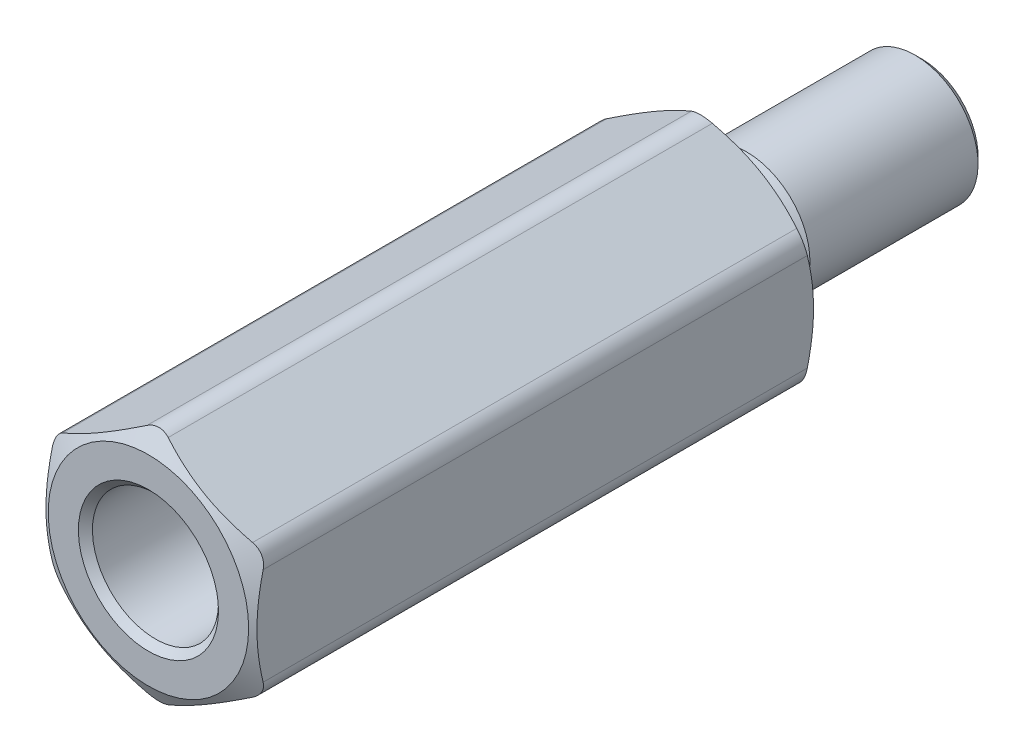
from build123d import *

# Parameters (mm, degrees)
SKETCH4_R           = 1.901825
BOSS_EXTRUDE1_DEPTH = 12.7
SKETCH5_OUTSIDE_W   = 75.8
SKETCH5_OUTSIDE_H   = 76.538
SKETCH5_OUTSIDE_R   = 2.2621875
CUT_EXTRUDE1_DEPTH  = 18.837312762
CUT_EXTRUDE1_DRAFT  = -60
SKETCH6_OUTSIDE_W   = 59.772
SKETCH6_OUTSIDE_H   = 60.51
SKETCH6_OUTSIDE_R   = 2.2621875
CUT_EXTRUDE2_DEPTH  = 14.210632851
CUT_EXTRUDE2_DRAFT  = -60
FILLET1_R           = 0.47625


with BuildPart() as part:
    # Sketch3 → Revolve1 (revolve)
    with BuildSketch(Plane(origin=(0, 0, 0), x_dir=(0, 0, -1), z_dir=(1, 0, 0))):
        with BuildLine():
            Line((-6.35, 1.26365), (-6.35, 0))
            Line((-6.35, 0), (4.7625, 0))
            Line((4.7625, 0), (4.7625, 1.26365))
            Line((4.7625, 1.26365), (4.60375, 1.4224))
            Line((4.60375, 1.4224), (0.809625, 1.4224))
            Line((0.809625, 1.4224), (0.5715, 1.009955401))
            Line((0.5715, 1.009955401), (0.15875, 1.009955401))
            ThreePointArc((0.15875, 1.009955401), (0.046496798, 1.0564522), (0, 1.168705401))
            Line((0, 1.168705401), (0, 2.38125))
            Line((0, 2.38125), (-12.7, 2.38125))
            Line((-12.7, 2.38125), (-12.7, 1.58115))
            Line((-12.7, 1.58115), (-12.54125, 1.4224))
            Line((-12.54125, 1.4224), (-6.50875, 1.4224))
            Line((-6.50875, 1.4224), (-6.35, 1.26365))
        make_face()
    revolve(axis=Axis((0, 0, -4.7625), (0, 0, 1)))

    # Sketch4 → Boss-Extrude1 (add)
    with BuildSketch(Plane.XY.offset(12.7)):
        Polygon((-2.38125, 1.374815329), (-2.38125, -1.374815329), (0, -2.749630657), (2.38125, -1.374815329), (2.38125, 1.374815329), (0, 2.749630657), align=None)
        Circle(SKETCH4_R, mode=Mode.SUBTRACT)
    extrude(amount=-BOSS_EXTRUDE1_DEPTH)


with BuildPart() as cut_extrude1_tool:
    # Sketch5 outside → Cut-Extrude1 (with draft: the straight prism first)
    with BuildSketch(Plane.XY.offset(12.7)):
        Rectangle(SKETCH5_OUTSIDE_W, SKETCH5_OUTSIDE_H)
        Circle(SKETCH5_OUTSIDE_R, mode=Mode.SUBTRACT)
    extrude(amount=-CUT_EXTRUDE1_DEPTH)
    # Cut-Extrude1: the draft: its side faces are tilted about the plane it starts from
    cut_extrude1_sides = [cut_extrude1_tool.faces().sort_by_distance(p)[0] for p in [
        (0, -38.269, 3.281343619),
        (37.9, 0, 3.281343619),
        (0, 38.269, 3.281343619),
        (-37.9, 0, 3.281343619),
        (-2.2621875, 0, 3.281343619),
    ]]
    draft(cut_extrude1_sides, Plane.XY.offset(12.7), CUT_EXTRUDE1_DRAFT)


with BuildPart() as part_1:
    add(part.part)

    # Cut-Extrude1: cut by cut_extrude1_tool
    add(cut_extrude1_tool.part, mode=Mode.SUBTRACT)


with BuildPart() as cut_extrude2_tool:
    # Sketch6 outside → Cut-Extrude2 (with draft: the straight prism first)
    with BuildSketch(Plane(origin=(0, 0, 0), x_dir=(-1, 0, 0), z_dir=(0, 0, -1))):
        Rectangle(SKETCH6_OUTSIDE_W, SKETCH6_OUTSIDE_H)
        Circle(SKETCH6_OUTSIDE_R, mode=Mode.SUBTRACT)
    extrude(amount=-CUT_EXTRUDE2_DEPTH)
    # Cut-Extrude2: the draft: its side faces are tilted about the plane it starts from
    cut_extrude2_sides = [cut_extrude2_tool.faces().sort_by_distance(p)[0] for p in [
        (0, -30.255, 7.105316425),
        (-29.886, 0, 7.105316425),
        (0, 30.255, 7.105316425),
        (29.886, 0, 7.105316425),
        (2.2621875, 0, 7.105316425),
    ]]
    draft(cut_extrude2_sides, Plane(origin=(0, 0, 0), x_dir=(-1, 0, 0), z_dir=(0, 0, -1)), CUT_EXTRUDE2_DRAFT)


with BuildPart() as part_2:
    add(part_1.part)

    # Cut-Extrude2: cut by cut_extrude2_tool
    add(cut_extrude2_tool.part, mode=Mode.SUBTRACT)

    # Fillet1
    fillet1_edges = [part_2.edges().sort_by_distance(p)[0] for p in [
        (0, 2.749630657, 6.35),
        (-2.38125, -1.374815329, 6.35),
        (0, -2.749630657, 6.35),
        (2.38125, -1.374815329, 6.35),
        (2.38125, 1.374815329, 6.35),
        (-2.38125, 1.374815329, 6.35),
    ]]
    fillet(fillet1_edges, radius=FILLET1_R)


solid = part_2.part
